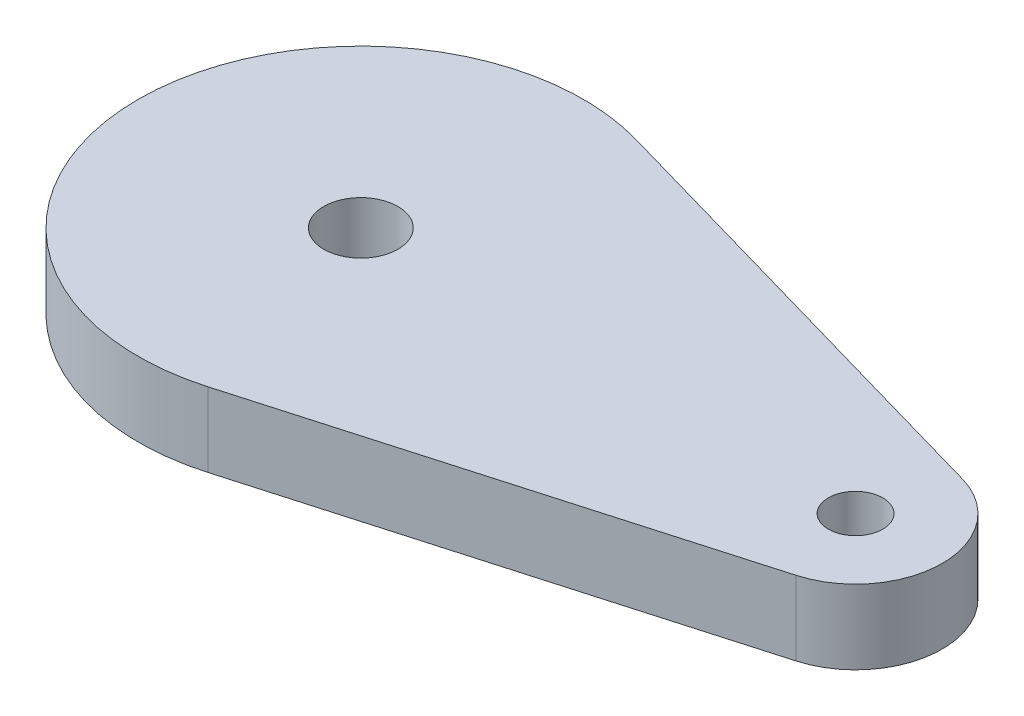
from build123d import *

# Parameters (mm, degrees)
EXTRUDE_1_DEPTH     = 3
SKETCH_2_R          = 1.5
SKETCH_2_R_2        = 1.1
CUT_EXTRUDE_1_DEPTH = 3


with BuildPart() as part:
    # 스케치1 → 보스-돌출1 (new body)
    with BuildSketch(Plane(origin=(0, 0, 0), x_dir=(1, 0, 0), z_dir=(0, 1, 0))):
        with BuildLine():
            Line((2.475, 8.652998035), (20.9625, 3.365054792))
            ThreePointArc((20.9625, 3.365054792), (23.5, 0), (20.9625, -3.365054792))
            Line((20.9625, -3.365054792), (2.475, -8.652998035))
            ThreePointArc((2.475, -8.652998035), (-9, 0), (2.475, 8.652998035))
        make_face()
    extrude(amount=EXTRUDE_1_DEPTH)

    # 스케치2 → 컷-돌출1 (cut)
    with BuildSketch(Plane(origin=(0, 3, 0), x_dir=(1, 0, 0), z_dir=(0, 1, 0))):
        with Locations(Location((0, 0, 0), (0, 0, 270))):
            Circle(SKETCH_2_R)
        with Locations(Location((20, 0, 0), (0, 0, 270))):
            Circle(SKETCH_2_R_2)
    extrude(amount=-CUT_EXTRUDE_1_DEPTH, mode=Mode.SUBTRACT)


solid = part.part
